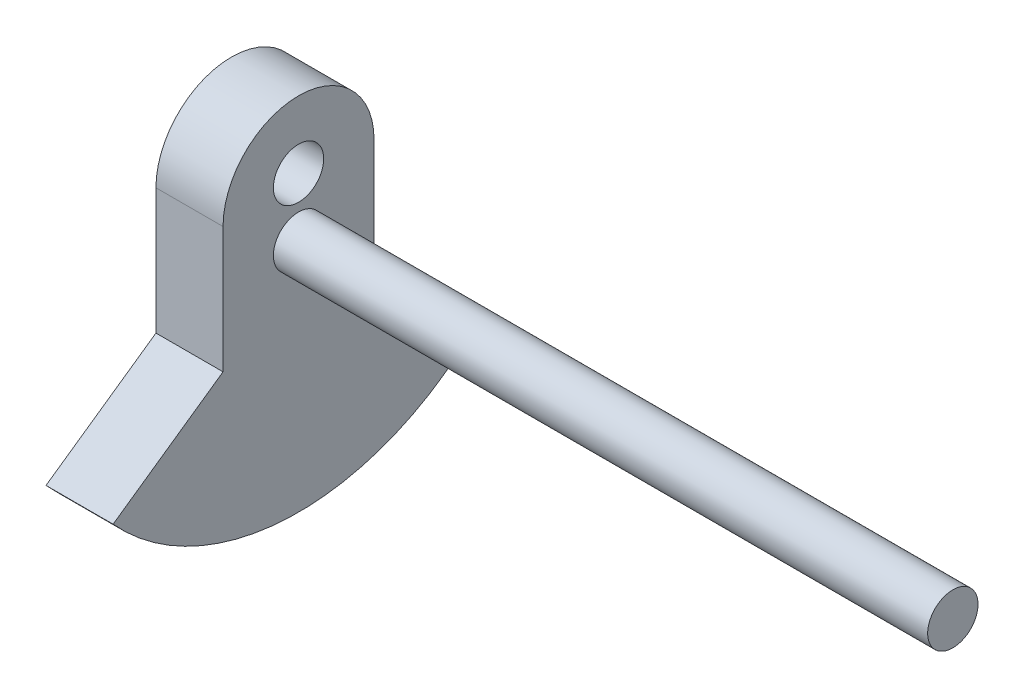
from build123d import *

# Parameters (mm, degrees)
SKETCH1_R           = 1.5
BOSS_EXTRUDE1_DEPTH = 4
SKETCH1_2_R         = 1.5
BOSS_EXTRUDE2_DEPTH = 43
CUT_EXTRUDE1_REACH  = 48.553
SKETCH2_R           = 1.5


with BuildPart() as part:
    # Sketch1 → Boss-Extrude1 (new body)
    with BuildSketch(Plane(origin=(0, 0, 0), x_dir=(0, 0, -1), z_dir=(1, 0, 0))):
        with BuildLine():
            Line((-4.5, -4.5), (-4.5, 3))
            ThreePointArc((-4.5, 3), (0, 7.5), (4.5, 3))
            Line((4.5, 3), (4.5, -4.5))
            Line((4.5, -4.5), (11.053216354, -9.088611491))
            ThreePointArc((11.053216354, -9.088611491), (0, -14), (-11.053216354, -9.088611491))
            Line((-11.053216354, -9.088611491), (-4.5, -4.5))
        make_face()
        Circle(SKETCH1_R, mode=Mode.SUBTRACT)
    extrude(amount=BOSS_EXTRUDE1_DEPTH)

    # Sketch1<2> → Boss-Extrude2 (add)
    with BuildSketch(Plane(origin=(0, 0, 0), x_dir=(0, 0, -1), z_dir=(1, 0, 0))):
        Circle(SKETCH1_2_R)
    extrude(amount=BOSS_EXTRUDE2_DEPTH)

    # Sketch2 → Cut-Extrude1 (cut, up to next)
    with BuildSketch(Plane.ZY, mode=Mode.PRIVATE) as cut_extrude1_sk1:
        with Locations((0, 3.5)):
            Circle(SKETCH2_R)
    cut_extrude1_tool1 = extrude(cut_extrude1_sk1.sketch, amount=-CUT_EXTRUDE1_REACH, mode=Mode.PRIVATE) & part.part
    add(cut_extrude1_tool1.solids().sort_by_distance((0, 3.5, 0))[0], mode=Mode.SUBTRACT)


solid = part.part
